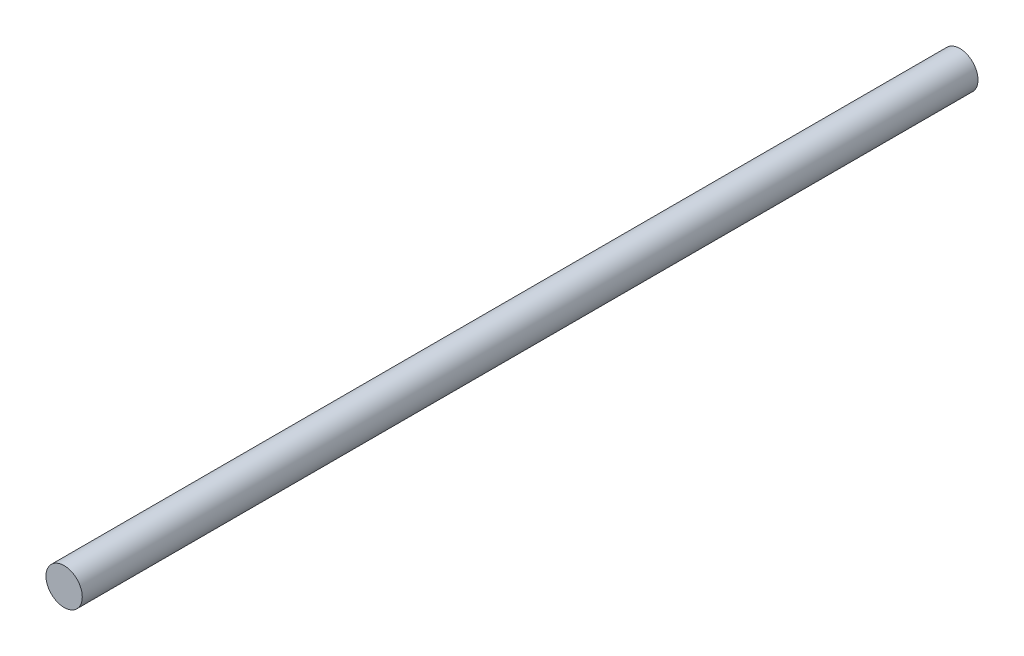
from build123d import *

# Parameters (mm, degrees)
ESQUISSE1_R        = 1.5
BOSS_EXTRU_1_DEPTH = 74


with BuildPart() as part:
    # Esquisse1 → Boss.-Extru.1 (new body)
    with BuildSketch(Plane.XY):
        Circle(ESQUISSE1_R)
    extrude(amount=BOSS_EXTRU_1_DEPTH)


solid = part.part
